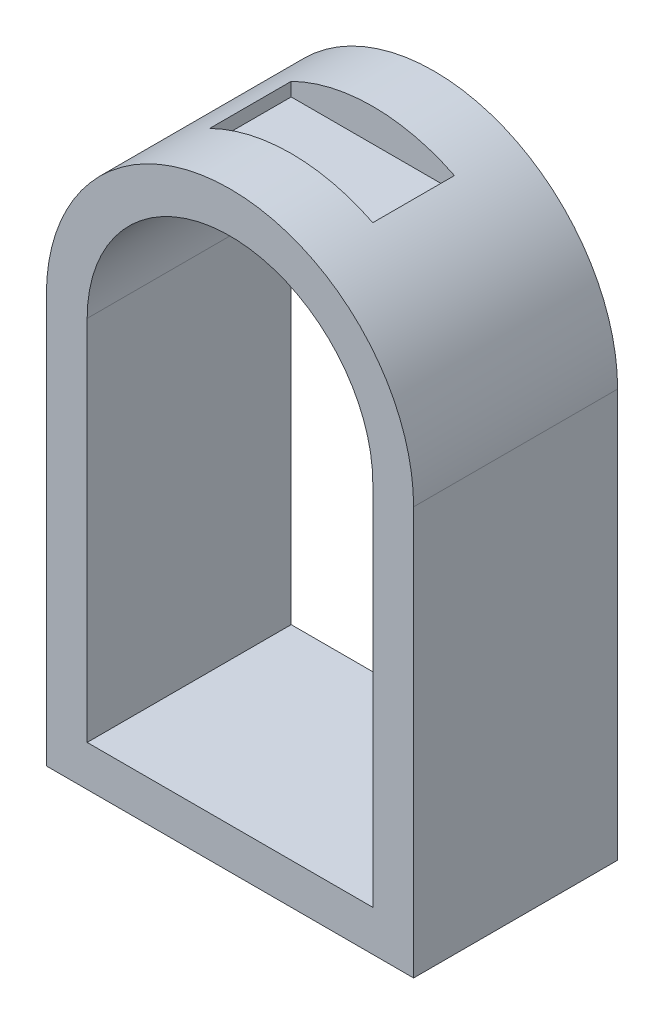
from build123d import *

# Parameters (mm, degrees)
EXTRUDE_THIN1_DEPTH = 127
SKETCH4_W           = 101.6
SKETCH4_H           = 50.8
CUT_EXTRUDE1_DEPTH  = 20.32


with BuildPart() as part:
    # Sketch1 → Extrude-Thin1 (new body)
    with BuildSketch(Plane.XY):
        with BuildLine():
            Line((-203.2, 228.6), (-203.2, -25.4))
            Line((-203.2, -25.4), (25.4, -25.4))
            Line((25.4, -25.4), (25.4, 228.6))
            ThreePointArc((25.4, 228.6), (-88.9, 342.9), (-203.2, 228.6))
        make_face()
        with BuildLine():
            Line((-177.8, 228.6), (-177.8, 0))
            Line((-177.8, 0), (0, 0))
            Line((0, 0), (0, 228.6))
            ThreePointArc((0, 228.6), (-88.9, 317.5), (-177.8, 228.6))
        make_face(mode=Mode.SUBTRACT)
    extrude(amount=EXTRUDE_THIN1_DEPTH)

    # Sketch4 → Cut-Extrude1 (cut)
    with BuildSketch(Plane(origin=(0, 342.9, 0), x_dir=(1, 0, 0), z_dir=(0, 1, 0))):
        with Locations((-88.9, -63.5)):
            Rectangle(SKETCH4_W, SKETCH4_H)
    extrude(amount=-CUT_EXTRUDE1_DEPTH, mode=Mode.SUBTRACT)


solid = part.part
